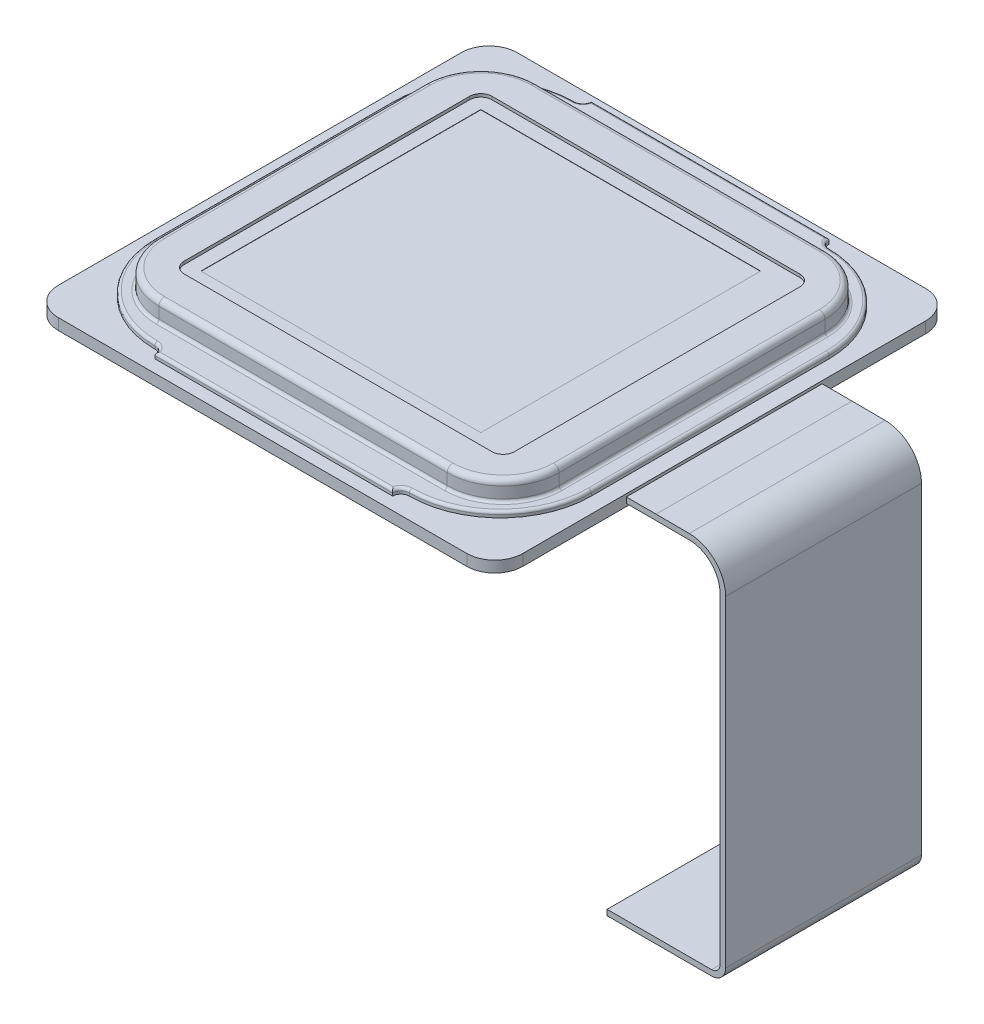
from build123d import *

# Parameters (mm, degrees)
EXTRUDE_1_DEPTH      = 0.4
EXTRUDE_2_DEPTH      = 0.6
EXTRUDE_3_DEPTH      = 1.3
EXTRUDE_4_DEPTH      = 1.19
FILLET_1_R           = 0.1
FILLET_2_R           = 0.1
FILLET_3_R           = 0.2
EXTRUDE_5_DEPTH      = 3.5
EXTRUDE_5_DEPTH_BACK = 3.5
EXTRUDE_5_START      = -8.2
SKETCH_3_W           = 10
SKETCH_3_H           = 10
CUT_EXTRUDE_1_DEPTH  = 0.01


with BuildPart() as part:
    # 草图1 → 凸台-拉伸1 (new body)
    with BuildSketch(Plane(origin=(0, 0, 0), x_dir=(1, 0, 0), z_dir=(0, 1, 0))):
        with BuildLine():
            Line((7.3, -8.2), (-7.3, -8.2))
            ThreePointArc((-7.3, -8.2), (-8.007106781, -7.907106781), (-8.3, -7.2))
            Line((-8.3, -7.2), (-8.3, 7.2))
            ThreePointArc((-8.3, 7.2), (-8.007106781, 7.907106781), (-7.3, 8.2))
            Line((-7.3, 8.2), (7.3, 8.2))
            ThreePointArc((7.3, 8.2), (8.007106781, 7.907106781), (8.3, 7.2))
            Line((8.3, 7.2), (8.3, -7.2))
            ThreePointArc((8.3, -7.2), (8.007106781, -7.907106781), (7.3, -8.2))
        make_face()
        with BuildLine():
            Line((7.75, -4.202947793), (7.75, 4.3))
            ThreePointArc((7.75, 4.3), (6.798097039, 6.598097039), (4.5, 7.55))
            ThreePointArc((4.5, 7.55), (4.287867966, 7.637867966), (4.2, 7.85))
            Line((4.2, 7.85), (-4.3, 7.85))
            ThreePointArc((-4.3, 7.85), (-4.387867966, 7.637867966), (-4.6, 7.55))
            ThreePointArc((-4.6, 7.55), (-6.898097039, 6.598097039), (-7.85, 4.3))
            Line((-7.85, 4.3), (-7.85, -4.2))
            ThreePointArc((-7.85, -4.2), (-6.898094676, -6.498099402), (-4.599993316, -7.45))
            ThreePointArc((-4.599993316, -7.45), (-4.387860883, -7.537867748), (-4.299992699, -7.75))
            Line((-4.299992699, -7.75), (4.200007301, -7.75))
            ThreePointArc((4.200007301, -7.75), (4.288905774, -7.539775891), (4.499993425, -7.452947793))
            ThreePointArc((4.499993425, -7.452947793), (6.798094714, -6.501047157), (7.75, -4.202947793))
        make_face(mode=Mode.SUBTRACT)
    extrude(amount=EXTRUDE_1_DEPTH)

    # 草图1<3> → 凸台-拉伸2 (add)
    with BuildSketch(Plane(origin=(0, 0, 0), x_dir=(1, 0, 0), z_dir=(0, 1, 0))):
        with BuildLine():
            Line((7.75, -4.202947793), (7.75, 4.3))
            ThreePointArc((7.75, 4.3), (6.798097039, 6.598097039), (4.5, 7.55))
            ThreePointArc((4.5, 7.55), (4.287867966, 7.637867966), (4.2, 7.85))
            Line((4.2, 7.85), (-4.3, 7.85))
            ThreePointArc((-4.3, 7.85), (-4.387867966, 7.637867966), (-4.6, 7.55))
            ThreePointArc((-4.6, 7.55), (-6.898097039, 6.598097039), (-7.85, 4.3))
            Line((-7.85, 4.3), (-7.85, -4.2))
            ThreePointArc((-7.85, -4.2), (-6.898094676, -6.498099402), (-4.599993316, -7.45))
            ThreePointArc((-4.599993316, -7.45), (-4.387860883, -7.537867748), (-4.299992699, -7.75))
            Line((-4.299992699, -7.75), (4.200007301, -7.75))
            ThreePointArc((4.200007301, -7.75), (4.288905774, -7.539775891), (4.499993425, -7.452947793))
            ThreePointArc((4.499993425, -7.452947793), (6.798094714, -6.501047157), (7.75, -4.202947793))
        make_face()
        with BuildLine():
            Line((5.15, -6.75), (-5.15, -6.75))
            ThreePointArc((-5.15, -6.75), (-6.564213562, -6.164213562), (-7.15, -4.75))
            Line((-7.15, -4.75), (-7.15, 4.75))
            ThreePointArc((-7.15, 4.75), (-6.564213562, 6.164213562), (-5.15, 6.75))
            Line((-5.15, 6.75), (5.15, 6.75))
            ThreePointArc((5.15, 6.75), (6.564213562, 6.164213562), (7.15, 4.75))
            Line((7.15, 4.75), (7.15, -4.75))
            ThreePointArc((7.15, -4.75), (6.564213562, -6.164213562), (5.15, -6.75))
        make_face(mode=Mode.SUBTRACT)
    extrude(amount=EXTRUDE_2_DEPTH)

    # 草图1<4> → 凸台-拉伸3 (add)
    with BuildSketch(Plane(origin=(0, 0, 0), x_dir=(1, 0, 0), z_dir=(0, 1, 0))):
        with BuildLine():
            Line((5.15, -6.75), (-5.15, -6.75))
            ThreePointArc((-5.15, -6.75), (-6.564213562, -6.164213562), (-7.15, -4.75))
            Line((-7.15, -4.75), (-7.15, 4.75))
            ThreePointArc((-7.15, 4.75), (-6.564213562, 6.164213562), (-5.15, 6.75))
            Line((-5.15, 6.75), (5.15, 6.75))
            ThreePointArc((5.15, 6.75), (6.564213562, 6.164213562), (7.15, 4.75))
            Line((7.15, 4.75), (7.15, -4.75))
            ThreePointArc((7.15, -4.75), (6.564213562, -6.164213562), (5.15, -6.75))
        make_face()
        with BuildLine():
            Line((5.5, -5.5), (-5.5, -5.5))
            ThreePointArc((-5.5, -5.5), (-5.782842712, -5.382842712), (-5.9, -5.1))
            Line((-5.9, -5.1), (-5.9, 5.1))
            ThreePointArc((-5.9, 5.1), (-5.782842712, 5.382842712), (-5.5, 5.5))
            Line((-5.5, 5.5), (5.5, 5.5))
            ThreePointArc((5.5, 5.5), (5.782842712, 5.382842712), (5.9, 5.1))
            Line((5.9, 5.1), (5.9, -5.1))
            ThreePointArc((5.9, -5.1), (5.782842712, -5.382842712), (5.5, -5.5))
        make_face(mode=Mode.SUBTRACT)
    extrude(amount=EXTRUDE_3_DEPTH)

    # 草图1<5> → 凸台-拉伸4 (add)
    with BuildSketch(Plane(origin=(0, 0, 0), x_dir=(1, 0, 0), z_dir=(0, 1, 0))):
        with BuildLine():
            Line((-5.9, -5.1), (-5.9, 5.1))
            ThreePointArc((-5.9, 5.1), (-5.782842712, 5.382842712), (-5.5, 5.5))
            Line((-5.5, 5.5), (5.5, 5.5))
            ThreePointArc((5.5, 5.5), (5.782842712, 5.382842712), (5.9, 5.1))
            Line((5.9, 5.1), (5.9, -5.1))
            ThreePointArc((5.9, -5.1), (5.782842712, -5.382842712), (5.5, -5.5))
            Line((5.5, -5.5), (-5.5, -5.5))
            ThreePointArc((-5.5, -5.5), (-5.782842712, -5.382842712), (-5.9, -5.1))
        make_face()
    extrude(amount=EXTRUDE_4_DEPTH)

    # 圆角1
    fillet_1_edges = [part.edges().sort_by_distance(p)[0] for p in [
        (-6.898094676, 0.6, 6.498099402),
        (-0.049992699, 0.6, 7.75),
        (4.288905774, 0.6, 7.539775891),
        (-4.387867966, 0.6, -7.637867966),
        (-7.85, 0.6, -0.05),
        (-4.387860883, 0.6, 7.537867748),
        (6.798094714, 0.6, 6.501047157),
        (7.75, 0.6, -0.048526103),
        (6.798097039, 0.6, -6.598097039),
        (4.287867966, 0.6, -7.637867966),
        (-0.05, 0.6, -7.85),
        (-6.898097039, 0.6, -6.598097039),
    ]]
    fillet(fillet_1_edges, radius=FILLET_1_R)

    # 圆角2
    fillet_2_edges = [part.edges().sort_by_distance(p)[0] for p in [
        (-6.564213562, 0.6, -6.164213562),
        (0, 0.6, -6.75),
        (6.564213562, 0.6, -6.164213562),
        (7.15, 0.6, 0),
        (6.564213562, 0.6, 6.164213562),
        (0, 0.6, 6.75),
        (-6.564213562, 0.6, 6.164213562),
        (-7.15, 0.6, 0),
    ]]
    fillet(fillet_2_edges, radius=FILLET_2_R)

    # 圆角3
    fillet_3_edges = [part.edges().sort_by_distance(p)[0] for p in [
        (-7.15, 1.3, 0),
        (-6.564213562, 1.3, 6.164213562),
        (0, 1.3, 6.75),
        (0, 1.3, -6.75),
        (-6.564213562, 1.3, -6.164213562),
        (6.564213562, 1.3, 6.164213562),
        (7.15, 1.3, 0),
        (6.564213562, 1.3, -6.164213562),
    ]]
    fillet(fillet_3_edges, radius=FILLET_3_R)

    # 草图2 → 凸台-拉伸5 (add, two sides: drawn at the far end of the back side and taken through both)
    with BuildSketch(Plane.XY.offset(8.2).offset(EXTRUDE_5_START - EXTRUDE_5_DEPTH_BACK)):
        with BuildLine():
            Line((8.3, 0.3), (9.365071607, 0.300002674))
            add(Edge.make_bspline(
                [(9.365071607, 0.300002674), (9.466251692, 0.300426751), (9.659413087, 0.300043909), (10.004363297, 0.297823417), (10.333713629, 0.295164588), (10.471404473, 0.294160487), (10.550486094, 0.293991669)],
                knots=[0.000465859, 0.000465859, 0.000465859, 0.000465859, 0.099748113, 0.199030367, 0.298312622, 0.397594876, 0.397594876, 0.397594876, 0.397594876], degree=3))
            ThreePointArc((10.550486094, 0.293991669), (11.467930406, -0.087748238), (11.847710954, -1.006005369))
            Line((11.847710954, -1.006005369), (11.847710954, -12.506005369))
            ThreePointArc((11.847710954, -12.506005369), (11.701264344, -12.85955876), (11.347710954, -13.006005369))
            Line((11.347710954, -13.006005369), (7.613209707, -13.006005369))
            Line((7.613209707, -13.006005369), (7.613209707, -12.806005369))
            Line((7.613209707, -12.806005369), (11.347710954, -12.806005369))
            ThreePointArc((11.347710954, -12.806005369), (11.559842988, -12.718137403), (11.647710954, -12.506005369))
            Line((11.647710954, -12.506005369), (11.647710954, -1.006005369))
            ThreePointArc((11.647710954, -1.006005369), (11.326358183, -0.229018566), (10.550059149, 0.093992125))
            add(Edge.make_bspline(
                [(10.550059149, 0.093992125), (10.470549094, 0.094161857), (10.331716757, 0.095173419), (10.002362016, 0.097833701), (9.657479111, 0.100049329), (9.465720155, 0.100426879), (9.365071614, 0.1000009)],
                knots=[0.000156882, 0.000156882, 0.000156882, 0.000156882, 0.099516381, 0.198875879, 0.298235377, 0.397594876, 0.397594876, 0.397594876, 0.397594876], degree=3))
            Line((9.365071614, 0.1000009), (8.3, 0.1))
            Line((8.3, 0.1), (8.3, 0.3))
        make_face()
    extrude(amount=EXTRUDE_5_DEPTH + EXTRUDE_5_DEPTH_BACK)

    # 草图3 → 切除-拉伸1 (cut)
    with BuildSketch(Plane(origin=(0, 1.19, 0), x_dir=(1, 0, 0), z_dir=(0, 1, 0))):
        with Locations((-0.4, 0)):
            Rectangle(SKETCH_3_W, SKETCH_3_H)
    extrude(amount=-CUT_EXTRUDE_1_DEPTH, mode=Mode.SUBTRACT)


solid = part.part
